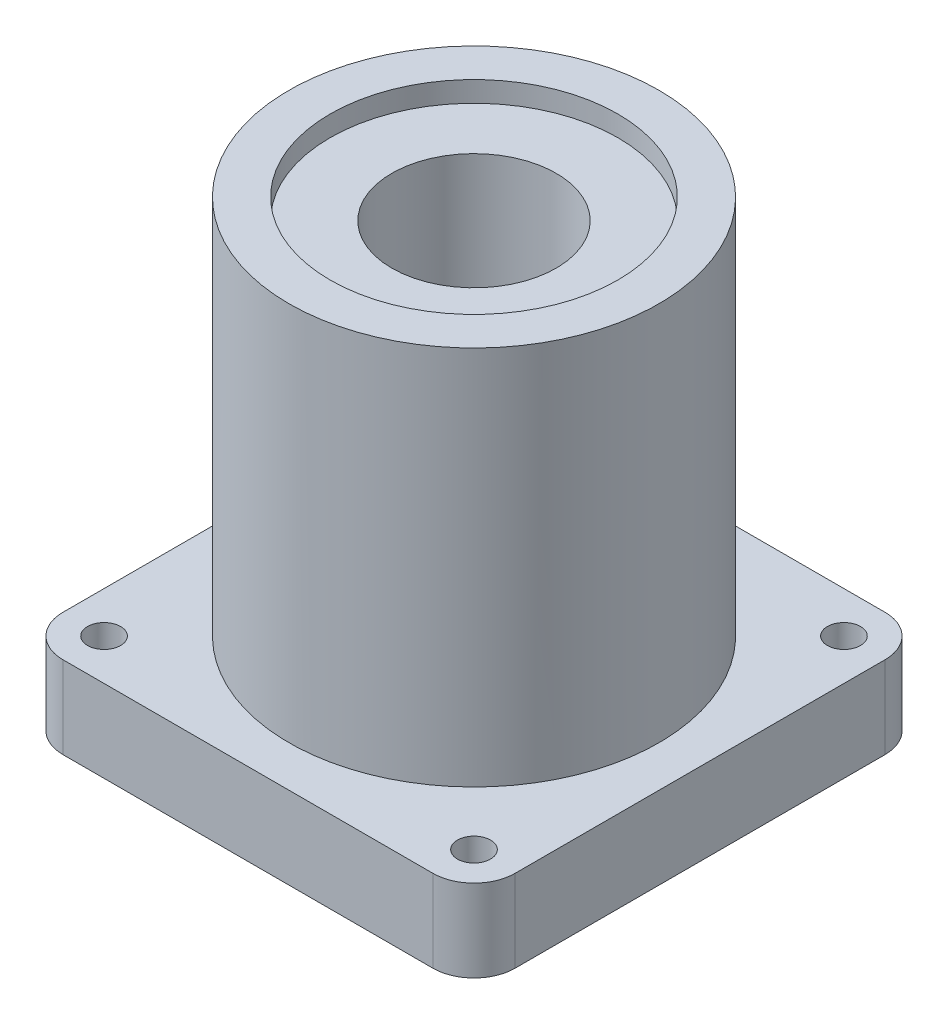
from build123d import *

# Parameters (mm, degrees)
SKETCH1_W           = 69.85
SKETCH1_H           = 69.85
BASE_EXTRUDE_DEPTH  = 12.7
SKETCH2_R           = 28.575
BOSS_EXTRUDE1_DEPTH = 71.4375
SKETCH3_R           = 12.7
CUT_EXTRUDE1_DEPTH  = 87.849453978
SKETCH4_R           = 22.225
CUT_EXTRUDE2_DEPTH  = 3.175
FILLET1_R           = 6.35
CIRPATTERN2_COUNT   = 4


with BuildPart() as part:
    # Sketch1 → Base-Extrude (new body)
    with BuildSketch(Plane(origin=(0, 0, 0), x_dir=(1, 0, 0), z_dir=(0, 1, 0))):
        Rectangle(SKETCH1_W, SKETCH1_H)
    extrude(amount=BASE_EXTRUDE_DEPTH)

    # Sketch2 → Boss-Extrude1 (add)
    with BuildSketch(Plane(origin=(0, 0, 0), x_dir=(-1, 0, 0), z_dir=(0, 1, 0))):
        with Locations(Location((0, 0, 0), (0, 0, 270))):
            Circle(SKETCH2_R)
    extrude(amount=BOSS_EXTRUDE1_DEPTH)

    # Sketch3 → Cut-Extrude1 (cut, through all)
    with BuildSketch(Plane(origin=(0, 71.4375, 0), x_dir=(-1, 0, 0), z_dir=(0, 1, 0))):
        with Locations(Location((0, 0, 0), (0, 0, 90))):
            Circle(SKETCH3_R)
    extrude(amount=-CUT_EXTRUDE1_DEPTH, mode=Mode.SUBTRACT)

    # Sketch4 → Cut-Extrude2 (cut)
    with BuildSketch(Plane(origin=(0, 71.4375, 0), x_dir=(-1, 0, 0), z_dir=(0, 1, 0))):
        with Locations(Location((0, 0, 0), (0, 0, 90))):
            Circle(SKETCH4_R)
    extrude(amount=-CUT_EXTRUDE2_DEPTH, mode=Mode.SUBTRACT)

    # Fillet1
    fillet1_edges = [part.edges().sort_by_distance(p)[0] for p in [
        (-34.925, 6.35, 34.925),
        (34.925, 6.35, 34.925),
        (34.925, 6.35, -34.925),
        (-34.925, 6.35, -34.925),
    ]]
    fillet(fillet1_edges, radius=FILLET1_R)

    # Sketch7 → 1/4-20 Tapped Hole2 (revolve, cut)
    with BuildSketch(Plane(origin=(-28.575, 12.7, -28.575), x_dir=(0, 0, 1), z_dir=(1, 0, 0))):
        Polygon((0, 0), (0, 20.583816902), (2.5527, 19.05), (2.5527, 0), align=None)
    f_1_4_20_tapped_hole2 = revolve(axis=Axis((-28.575, 19.05, -28.575), (0, -1, 0)), mode=Mode.SUBTRACT)

    # CirPattern2: 1/4-20 Tapped Hole2 ×4 about axis
    cirpattern2_axis = Axis((0, 0, 0), (0, 1, 0))
    for i in range(1, CIRPATTERN2_COUNT):
        add(f_1_4_20_tapped_hole2.rotate(cirpattern2_axis, i * 360 / CIRPATTERN2_COUNT), mode=Mode.SUBTRACT)


solid = part.part
